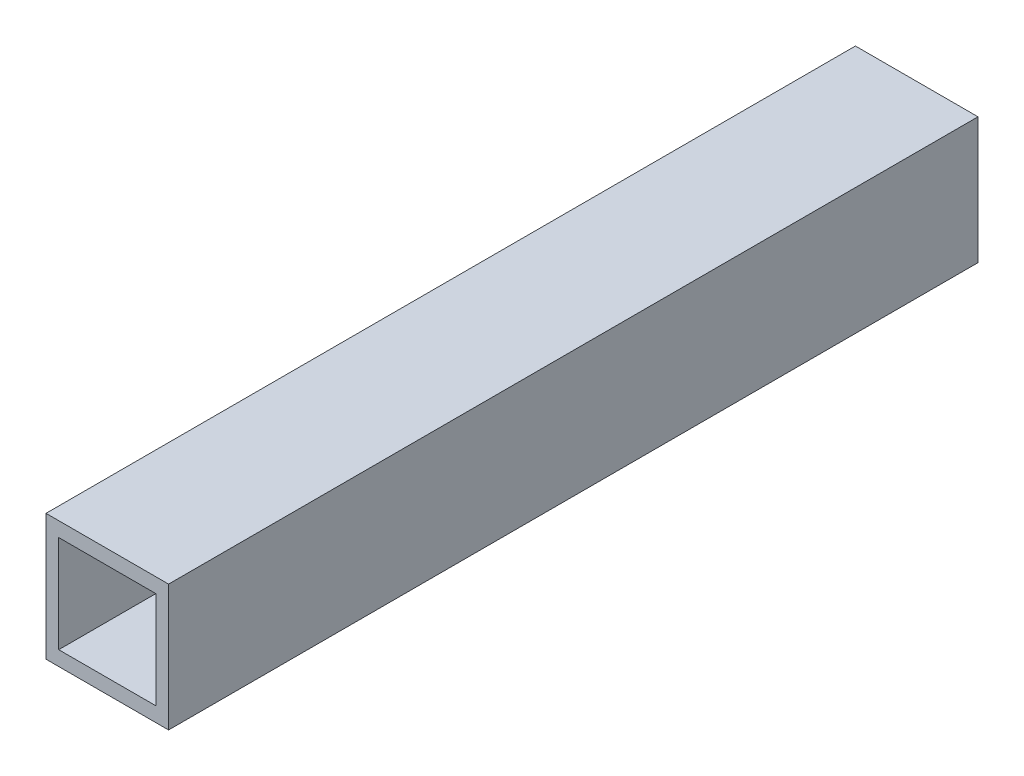
from build123d import *

# Parameters (mm, degrees)
SKETCH3_W           = 9.616935552
SKETCH3_H           = 9.912195066
SKETCH3_W_2         = 7.62
SKETCH3_H_2         = 7.62
BOSS_EXTRUDE2_DEPTH = 63.5
CUT_EXTRUDE1_DEPTH  = 1.27


with BuildPart() as part:
    # Sketch3 → Boss-Extrude2 (new body)
    with BuildSketch(Plane.XY):
        Rectangle(SKETCH3_W, SKETCH3_H)
        Rectangle(SKETCH3_W_2, SKETCH3_H_2, mode=Mode.SUBTRACT)
    extrude(amount=BOSS_EXTRUDE2_DEPTH)

    # Sketch6 → Cut-Extrude1 (cut)
    with BuildSketch(Plane(origin=(0, -3.81, 0), x_dir=(1, 0, 0), z_dir=(0, 1, 0))):
        Polygon((0, 0), (-3.048, 0), (-3.048, -1.27), (3.048, -1.27), (3.048, 0), align=None)
    extrude(amount=-CUT_EXTRUDE1_DEPTH, mode=Mode.SUBTRACT)


solid = part.part
